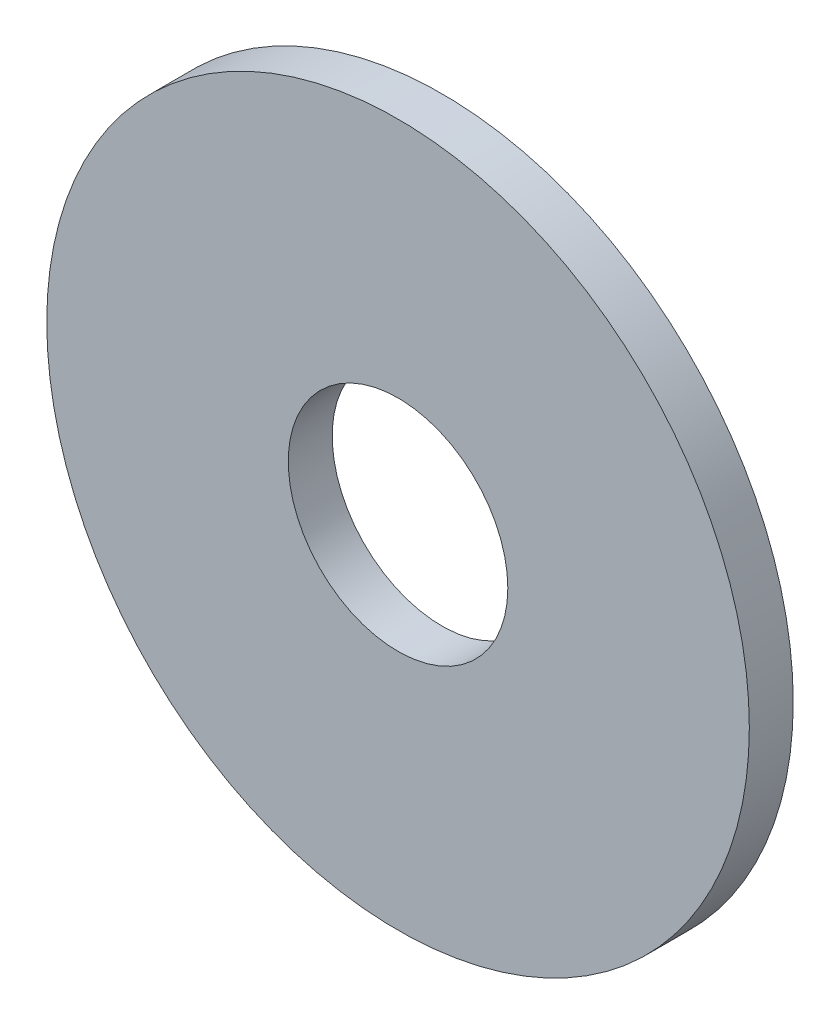
from build123d import *

# Parameters (mm, degrees)
SKETCH1_R           = 16
SKETCH1_R_2         = 5
BOSS_EXTRUDE1_DEPTH = 2


with BuildPart() as part:
    # Sketch1 → Boss-Extrude1 (new body)
    with BuildSketch(Plane.XY):
        Circle(SKETCH1_R)
        Circle(SKETCH1_R_2, mode=Mode.SUBTRACT)
    extrude(amount=BOSS_EXTRUDE1_DEPTH)


solid = part.part
